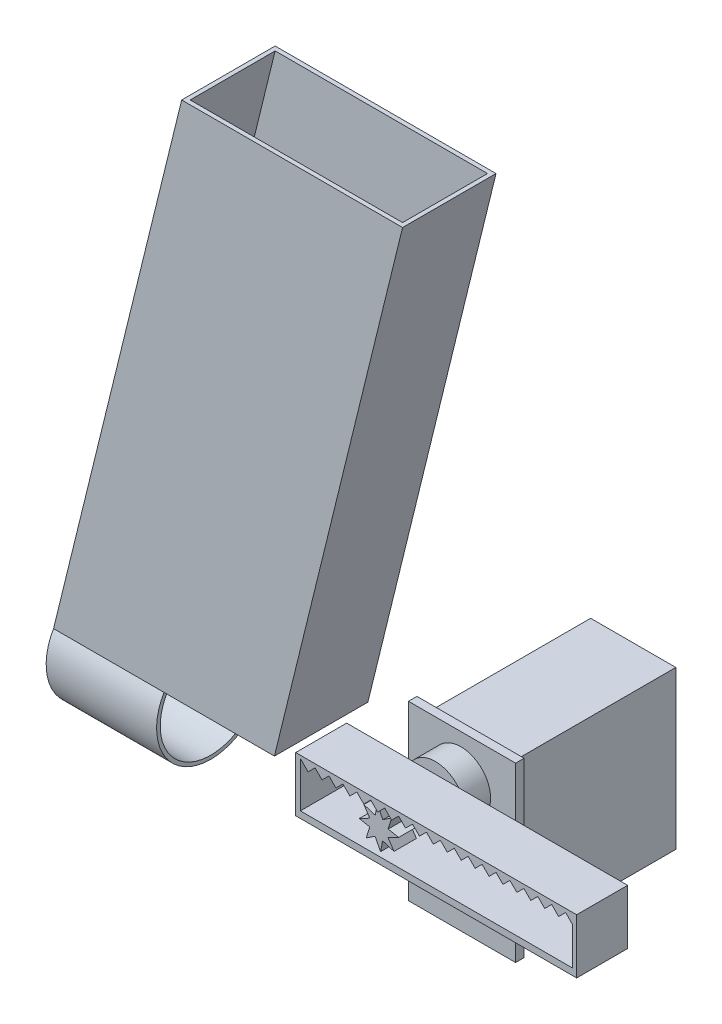
from build123d import *

# Parameters (mm, degrees)
SKETCH_1_W           = 26
SKETCH_1_H           = 11
SKETCH_1_W_2         = 25
SKETCH_1_H_2         = 10
EXTRUDE_1_DEPTH      = 13
EXTRUDE_3_DEPTH      = 3
EXTRUDE_3_DEPTH_BACK = 3
SKETCH_6_W           = 33.070370948
SKETCH_6_H           = 6.448093374
EXTRUDE_11_DEPTH     = 2.641307104
SKETCH_9_R           = 0.8
EXTRUDE_12_DEPTH     = 4
EXTRUDE_START        = -4
SKETCH_10_R          = 3.5
EXTRUDE_13_DEPTH     = 3
EXTRUDE_START_2      = -7
SKETCH_11_W          = 12.612855994
SKETCH_11_H          = 20.328900567
EXTRUDE_14_DEPTH     = 1
EXTRUDE_START_3      = -8
SKETCH_12_W          = 10.024040608
SKETCH_12_H          = 18.546773162
EXTRUDE_15_DEPTH     = 19.16229195


with BuildPart() as part:
    # 扫描1: sweep along a path in 草图2
    with BuildLine(Plane.XY) as sweep_1_path:
        Line((0, 0), (15.081446117, 61.427097956))
    # 草图1 → 扫描1 (sweep)
    with BuildSketch(Plane(origin=(0, 0, 0), x_dir=(1, 0, 0), z_dir=(0, 1, 0))):
        Rectangle(SKETCH_1_W, SKETCH_1_H)
        Rectangle(SKETCH_1_W_2, SKETCH_1_H_2, mode=Mode.SUBTRACT)
    sweep(path=sweep_1_path.line)

    # 草图3 → 凸台-拉伸1 (add)
    with BuildSketch(Plane(origin=(0, 0, 0), x_dir=(0, 0, -1), z_dir=(1, 0, 0))):
        with BuildLine():
            Line((-5.5, 0), (-5, 0))
            ThreePointArc((-5, 0), (0, -9.160017332), (5, 0))
            Line((5, 0), (5.5, 0))
            ThreePointArc((5.5, 0), (0, -9.586307333), (-5.5, 0))
        make_face()
    extrude(amount=-EXTRUDE_1_DEPTH)


with BuildPart() as body_2:
    # 草图6 → 凸台-拉伸3 (new, two sides: drawn at the far end of the back side and taken through both)
    with BuildSketch(Plane.XY.offset(-EXTRUDE_3_DEPTH_BACK)):
        with Locations((29.535185474, -4.106366023)):
            Rectangle(SKETCH_6_W, SKETCH_6_H)
        Polygon((13.553337787, -2.125143793), (13.553337787, -6.554523321), (45.590493828, -6.554523321), (45.590493828, -2.125143793), (44.771361998, -1.306011962), (43.952230167, -2.125143793), (43.133098336, -1.306011962), (42.313966506, -2.125143793), (41.494834675, -1.306011962), (40.675702845, -2.125143793), (39.856571014, -1.306011962), (39.037439183, -2.125143793), (38.218307353, -1.306011962), (37.399175522, -2.125143793), (36.580043692, -1.306011962), (35.760911861, -2.125143793), (34.94178003, -1.306011962), (34.1226482, -2.125143793), (33.303516369, -1.306011962), (32.484384538, -2.125143793), (31.665252708, -1.306011962), (30.846120877, -2.125143793), (30.026989047, -1.306011962), (29.207857216, -2.125143793), (28.388725385, -1.306011962), (27.569593555, -2.125143793), (26.750461724, -1.306011962), (25.931329894, -2.125143793), (25.112198063, -1.306011962), (24.293066232, -2.125143793), (23.473934402, -1.306011962), (22.654802571, -2.125143793), (21.835670741, -1.306011962), (21.01653891, -2.125143793), (20.197407079, -1.306011962), (19.378275249, -2.125143793), (18.559143418, -1.306011962), (17.740011588, -2.125143793), (16.920879757, -1.306011962), (16.101747926, -2.125143793), (15.282616096, -1.306011962), (14.463484265, -2.125143793), (13.553337787, -1.214997314), align=None, mode=Mode.SUBTRACT)
    extrude(amount=EXTRUDE_3_DEPTH + EXTRUDE_3_DEPTH_BACK)


with BuildPart() as body_3:
    # 草图7 → 凸台-拉伸11 (new body)
    with BuildSketch(Plane.XY):
        Polygon((22.245236656, -1.715577878), (22.901203318, -2.961488175), (23.940247657, -2.256017546), (23.523094513, -3.600847641), (24.756652876, -3.836719874), (23.510742579, -4.492686537), (24.216213207, -5.531730876), (22.871383112, -5.114577731), (22.635510879, -6.348136094), (21.979544217, -5.102225797), (20.940499878, -5.807696426), (21.357653022, -4.462866331), (20.124094659, -4.226994098), (21.370004956, -3.571027435), (20.664534328, -2.531983096), (22.009364423, -2.949136241), align=None)
    extrude(amount=EXTRUDE_11_DEPTH)

    # 草图9 → 凸台-拉伸12 (add)
    with BuildSketch(Plane.XY):
        with Locations((22.444532426, -4.070813094)):
            Circle(SKETCH_9_R)
    extrude(amount=-EXTRUDE_12_DEPTH)

    # 草图10 → 凸台-拉伸13 (add)
    with BuildSketch(Plane.XY.offset(EXTRUDE_START)):
        with Locations((22.444532426, -4.070813094)):
            Circle(SKETCH_10_R)
    extrude(amount=-EXTRUDE_13_DEPTH)

    # 草图11 → 凸台-拉伸14 (add)
    with BuildSketch(Plane.XY.offset(EXTRUDE_START_2)):
        with Locations((22.579748606, -9.185183134)):
            Rectangle(SKETCH_11_W, SKETCH_11_H)
    extrude(amount=-EXTRUDE_14_DEPTH)

    # 草图12 → 凸台-拉伸15 (add)
    with BuildSketch(Plane.XY.offset(EXTRUDE_START_3)):
        with Locations((22.568813032, -9.273386581)):
            Rectangle(SKETCH_12_W, SKETCH_12_H)
    extrude(amount=-EXTRUDE_15_DEPTH)


solid = Compound([part.part, body_2.part, body_3.part])
